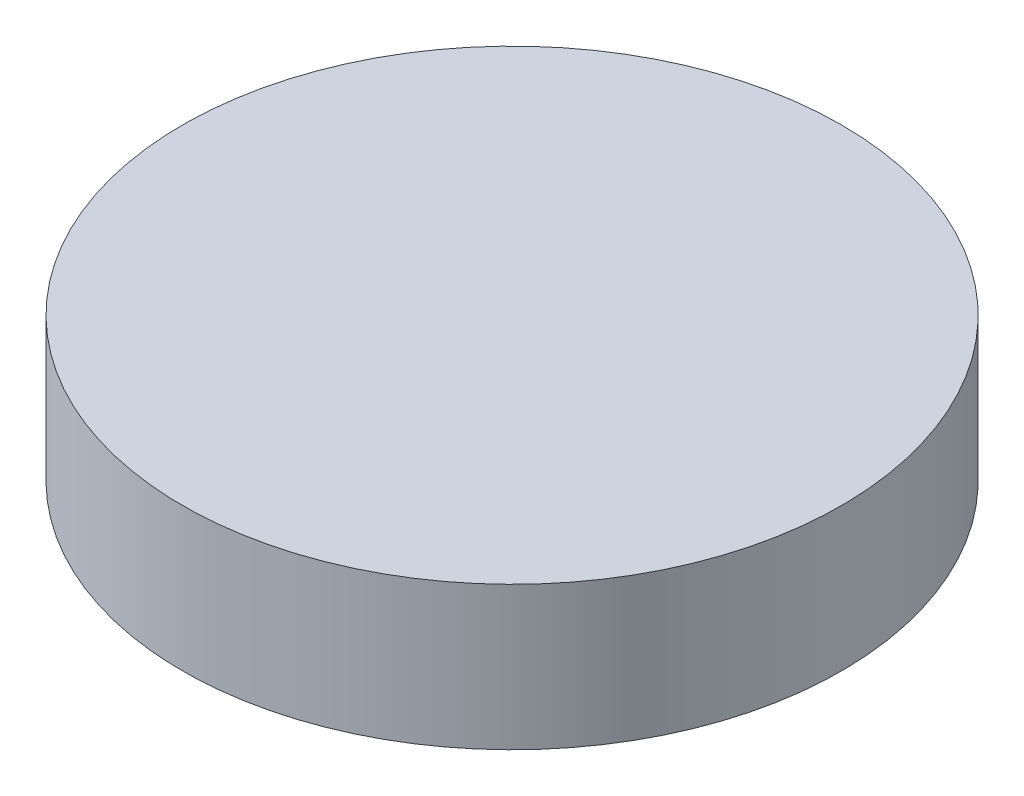
from build123d import *

# Parameters (mm, degrees)
SKETCH_1_W = 11.5
SKETCH_1_H = 5


with BuildPart() as part:
    # 草图1 → Revolve 2 (revolve)
    with BuildSketch(Plane.XY, mode=Mode.PRIVATE) as revolve_2_sk:
        with Locations((5.75, 2.5)):
            Rectangle(SKETCH_1_W, SKETCH_1_H)
    revolve(revolve_2_sk.sketch.rotate(Axis((0, 0, 0), (0, 1, 0)), 90), axis=Axis((0, 0, 0), (0, 1, 0)))


solid = part.part
